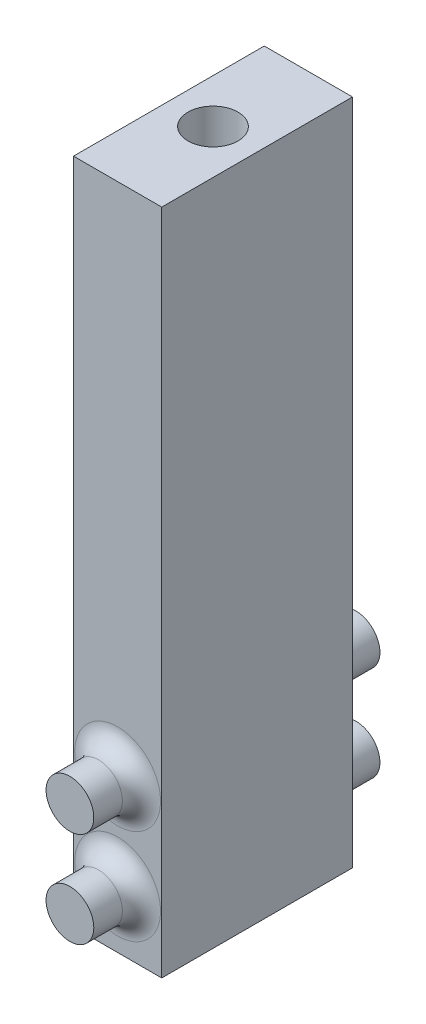
from build123d import *

# Parameters (mm, degrees)
SKETCH1_W               = 9.25
SKETCH1_H               = 20
BOSS_EXTRUDE1_DEPTH     = 70
SKETCH2_R               = 2.625
CUT_EXTRUDE1_DEPTH      = 22
SKETCH4_R               = 5.5
CUT_EXTRUDE3_DEPTH      = 20
SKETCH5_W               = 2.148979486
SKETCH5_H               = 5
CUT_EXTRUDE4_DEPTH      = 7
CUT_EXTRUDE5_DEPTH      = 86.328689654
CUT_EXTRUDE5_DEPTH_BACK = 4
SKETCH6_W               = 4.5
SKETCH6_H               = 4
SKETCH7_R               = 2.5
BOSS_EXTRUDE2_DEPTH     = 5
FILLET1_R               = 2


with BuildPart() as part:
    # Sketch1 → Boss-Extrude1 (new body)
    with BuildSketch(Plane(origin=(0, 0, 0), x_dir=(1, 0, 0), z_dir=(0, 1, 0))):
        with Locations((28.297124636, -38.360472269)):
            Rectangle(SKETCH1_W, SKETCH1_H)
    extrude(amount=BOSS_EXTRUDE1_DEPTH)

    # Sketch2 → Cut-Extrude1 (cut)
    with BuildSketch(Plane(origin=(0, 70, 0), x_dir=(1, 0, 0), z_dir=(0, 1, 0))):
        with Locations((28.297124636, -38.360472269)):
            Circle(SKETCH2_R)
    extrude(amount=-CUT_EXTRUDE1_DEPTH, mode=Mode.SUBTRACT)

    # Sketch4 → Cut-Extrude3 (cut)
    with BuildSketch(Plane(origin=(0, 0, 0), x_dir=(-1, 0, 0), z_dir=(0, -1, 0))):
        with Locations((-20.922124636, -38.360472269)):
            Circle(SKETCH4_R)
    extrude(amount=-CUT_EXTRUDE3_DEPTH, mode=Mode.SUBTRACT)

    # Sketch5 → Cut-Extrude4 (cut)
    with BuildSketch(Plane(origin=(0, 20, 0), x_dir=(-1, 0, 0), z_dir=(0, -1, 0))):
        with Locations((-24.746614379, -38.360472269)):
            Rectangle(SKETCH5_W, SKETCH5_H)
    extrude(amount=-CUT_EXTRUDE4_DEPTH, mode=Mode.SUBTRACT)

    # Sketch6 → Cut-Extrude5 (cut, two sides: drawn at the far end of the back side and taken through both)
    with BuildSketch(Plane.ZY.offset(-26.422124636).offset(-CUT_EXTRUDE5_DEPTH_BACK)):
        with Locations((38.360472269, 18)):
            Rectangle(SKETCH6_W, SKETCH6_H)
    extrude(amount=CUT_EXTRUDE5_DEPTH + CUT_EXTRUDE5_DEPTH_BACK, mode=Mode.SUBTRACT)

    # Sketch7 → Boss-Extrude2 (add)
    with BuildSketch(Plane.XY.offset(48.360472269)):
        with Locations((28.297124636, 6)):
            Circle(SKETCH7_R)
        with Locations((28.297124636, 16)):
            Circle(SKETCH7_R)
    boss_extrude2 = extrude(amount=BOSS_EXTRUDE2_DEPTH)

    # Mirror1: Boss-Extrude2 across plane
    add(boss_extrude2.mirror(Plane(origin=(0, 0, 38.360472269), x_dir=(1, 0, 0), z_dir=(0, 0, -1))))

    # Fillet1
    fillet1_edges = [part.edges().sort_by_distance(p)[0] for p in [
        (25.797124636, 16, 28.360472269),
        (25.797124636, 6, 28.360472269),
        (25.797124636, 6, 48.360472269),
        (25.797124636, 16, 48.360472269),
    ]]
    fillet(fillet1_edges, radius=FILLET1_R)


solid = part.part
